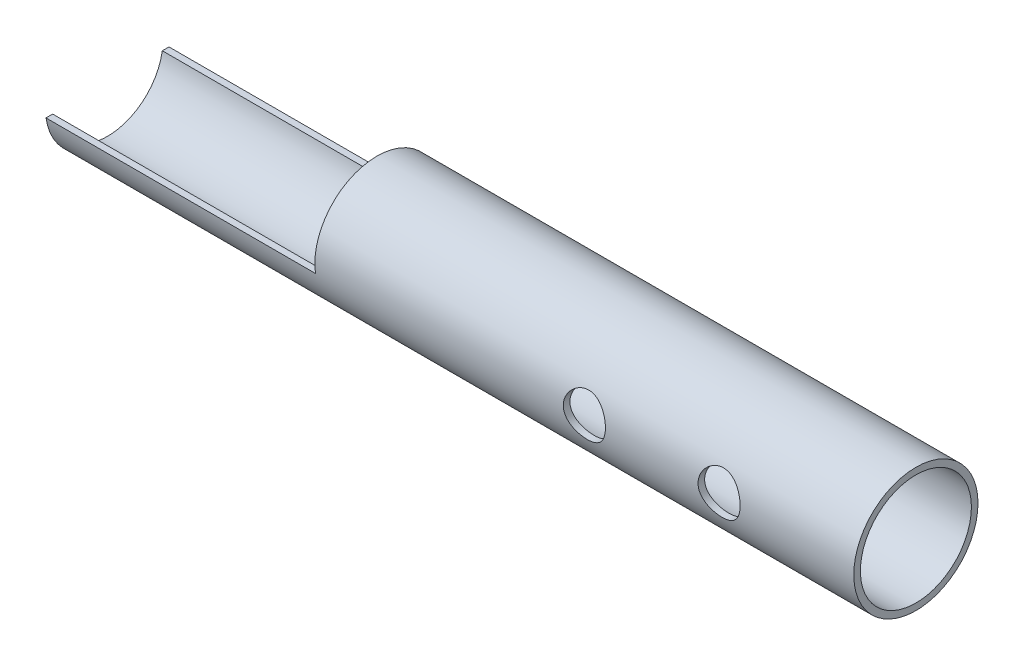
from build123d import *

# Parameters (mm, degrees)
SKETCH3_R               = 11.7094
SKETCH3_R_2             = 10.4648
BOSS_EXTRUDE1_DEPTH     = 152.4
CUT_EXTRUDE1_DEPTH      = 154.29703225
CUT_EXTRUDE1_DEPTH_BACK = 154.29703225
SKETCH4_W               = 50.8
SKETCH4_H               = 19.05
SKETCH8_R               = 3.96875
CUT_EXTRUDE2_DEPTH      = 155.632823947


with BuildPart() as part:
    # Sketch3 → Boss-Extrude1 (new body)
    with BuildSketch(Plane(origin=(0, 0, 0), x_dir=(0, 0, -1), z_dir=(1, 0, 0))):
        with Locations(Location((0, 0, 0), (0, 0, 180))):
            Circle(SKETCH3_R)
        with Locations(Location((0, 0, 0), (0, 0, 180))):
            Circle(SKETCH3_R_2, mode=Mode.SUBTRACT)
    extrude(amount=BOSS_EXTRUDE1_DEPTH)

    # Sketch4 → Cut-Extrude1 (cut, two sides: drawn at the far end of the back side and taken through both)
    with BuildSketch(Plane.XY.offset(-CUT_EXTRUDE1_DEPTH_BACK)):
        with Locations((25.4, 7.867878263)):
            Rectangle(SKETCH4_W, SKETCH4_H)
    extrude(amount=CUT_EXTRUDE1_DEPTH + CUT_EXTRUDE1_DEPTH_BACK, mode=Mode.SUBTRACT)

    # Sketch8 → Cut-Extrude2 (cut, through all)
    with BuildSketch(Plane.XY.offset(11.7094)):
        with Locations((101.6, 0.381)):
            Circle(SKETCH8_R)
        with Locations((127, 0.381)):
            Circle(SKETCH8_R)
    extrude(amount=-CUT_EXTRUDE2_DEPTH, mode=Mode.SUBTRACT)


solid = part.part
